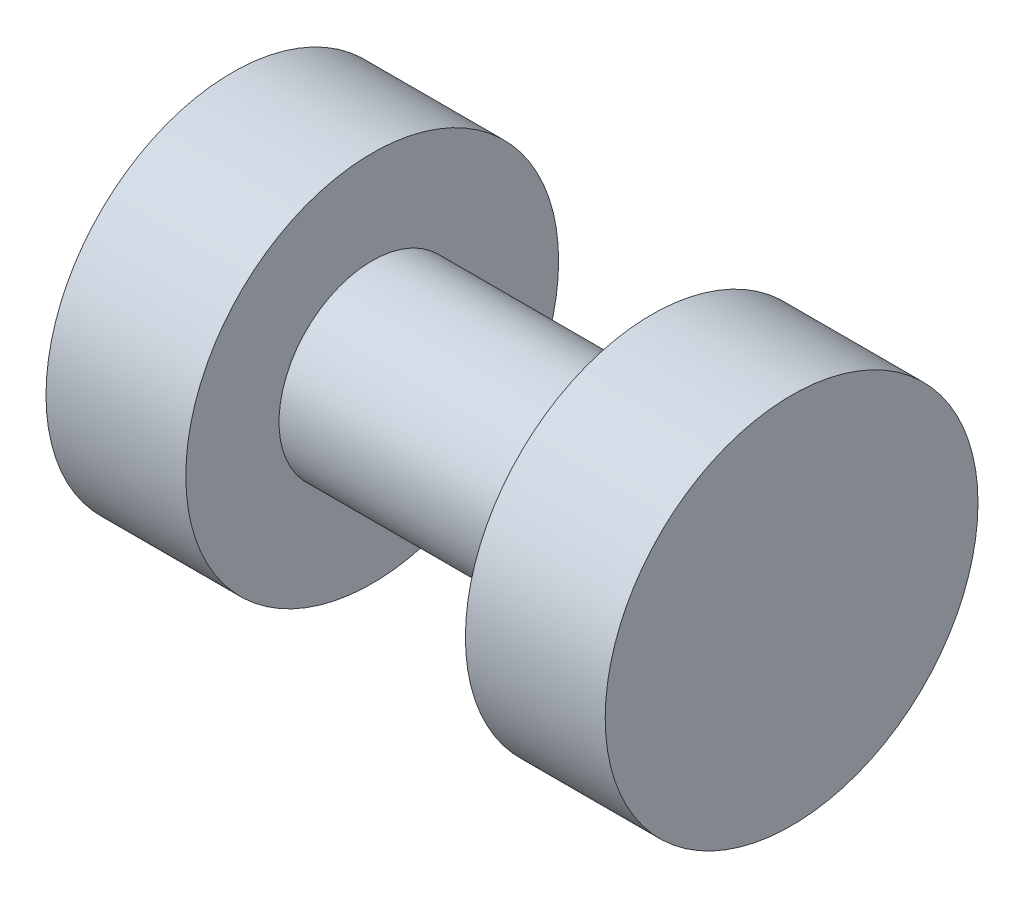
from build123d import *


with BuildPart() as part:
    # Croquis1 → Revolución1 (revolve)
    with BuildSketch(Plane.XY, mode=Mode.PRIVATE) as revoluci_n1_sk:
        Polygon((0, 0), (0, 10), (7.5, 10), (7.5, 5), (22.5, 5), (22.5, 10), (30, 10), (30, 0), align=None)
    revolve(revoluci_n1_sk.sketch.rotate(Axis((30, 0, 0), (-1, 0, 0)), 90), axis=Axis((30, 0, 0), (-1, 0, 0)))


solid = part.part
